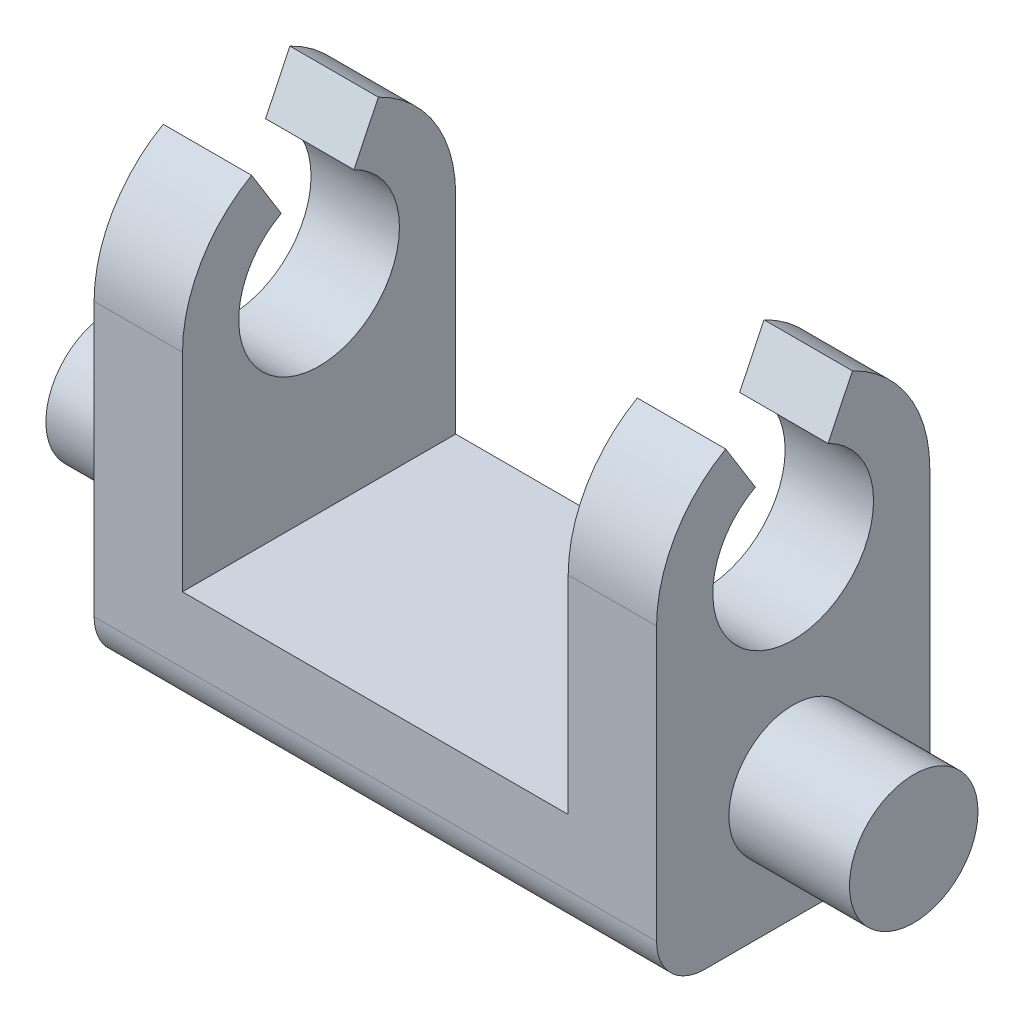
from build123d import *

# Parameters (mm, degrees)
SKETCH1_R               = 8
BOSS_EXTRUDE1_DEPTH     = 50
SKETCH2_R               = 10
BOSS_EXTRUDE2_DEPTH     = 35
CUT_EXTRUDE1_DEPTH      = 68.475921631
CUT_EXTRUDE1_DEPTH_BACK = 68.475921631
SKETCH3_W               = 48
SKETCH3_H               = 42.81
CUT_EXTRUDE2_REACH      = 98.322


with BuildPart() as part:
    # Sketch1 → Boss-Extrude1 (new, symmetric)
    with BuildSketch(Plane(origin=(0, 0, 0), x_dir=(0, 0, -1), z_dir=(1, 0, 0))):
        Circle(SKETCH1_R)
    extrude(amount=BOSS_EXTRUDE1_DEPTH, both=True)

    # Sketch2 → Boss-Extrude2 (add, symmetric)
    with BuildSketch(Plane(origin=(0, 0, 0), x_dir=(0, 0, -1), z_dir=(1, 0, 0))):
        with BuildLine():
            Line((-11, -15), (11, -15))
            ThreePointArc((11, -15), (15.242640687, -13.242640687), (17, -9))
            Line((17, -9), (17, 25))
            ThreePointArc((17, 25), (0, 42), (-17, 25))
            Line((-17, 25), (-17, -9))
            ThreePointArc((-17, -9), (-15.242640687, -13.242640687), (-11, -15))
        make_face()
        with Locations((0, 25)):
            Circle(SKETCH2_R, mode=Mode.SUBTRACT)
    extrude(amount=BOSS_EXTRUDE2_DEPTH, both=True)

    # Sketch3 → Cut-Extrude1 (cut, two sides: drawn at the far end of the back side and taken through both)
    with BuildSketch(Plane.XY.offset(-CUT_EXTRUDE1_DEPTH_BACK)):
        with Locations((0, 20.595)):
            Rectangle(SKETCH3_W, SKETCH3_H)
    extrude(amount=CUT_EXTRUDE1_DEPTH + CUT_EXTRUDE1_DEPTH_BACK, mode=Mode.SUBTRACT)

    # Cut-Extrude2: up to this face of the body (flat: up to its plane)
    cut_extrude2_end = Plane(part.part.faces().sort_by_distance((-35, 10.739149223, 0))[0])
    # Sketch4 → Cut-Extrude2 (cut, up to the picked face)
    with BuildSketch(Plane(origin=(35, 0, 0), x_dir=(0, 0, -1), z_dir=(1, 0, 0)), mode=Mode.PRIVATE) as cut_extrude2_sk1:
        with BuildLine():
            Line((-8.398206087, 39.78073525), (-4.706155375, 33.823383795))
            ThreePointArc((-4.706155375, 33.823383795), (-0.206218371, 34.997873473), (4.338321313, 34.009937191))
            Line((4.338321313, 34.009937191), (7.375146233, 40.316893224))
            ThreePointArc((7.375146233, 40.316893224), (-0.577519878, 41.990187485), (-8.398206087, 39.78073525))
        make_face()
    cut_extrude2_tool1 = split(extrude(cut_extrude2_sk1.sketch, amount=-CUT_EXTRUDE2_REACH, mode=Mode.PRIVATE), bisect_by=cut_extrude2_end, keep=Keep.BOTH, mode=Mode.PRIVATE)
    add(cut_extrude2_tool1.solids().sort_by(Axis((35, 38.290838, 0.393307), (-1, 0, 0)))[0], mode=Mode.SUBTRACT)


solid = part.part
